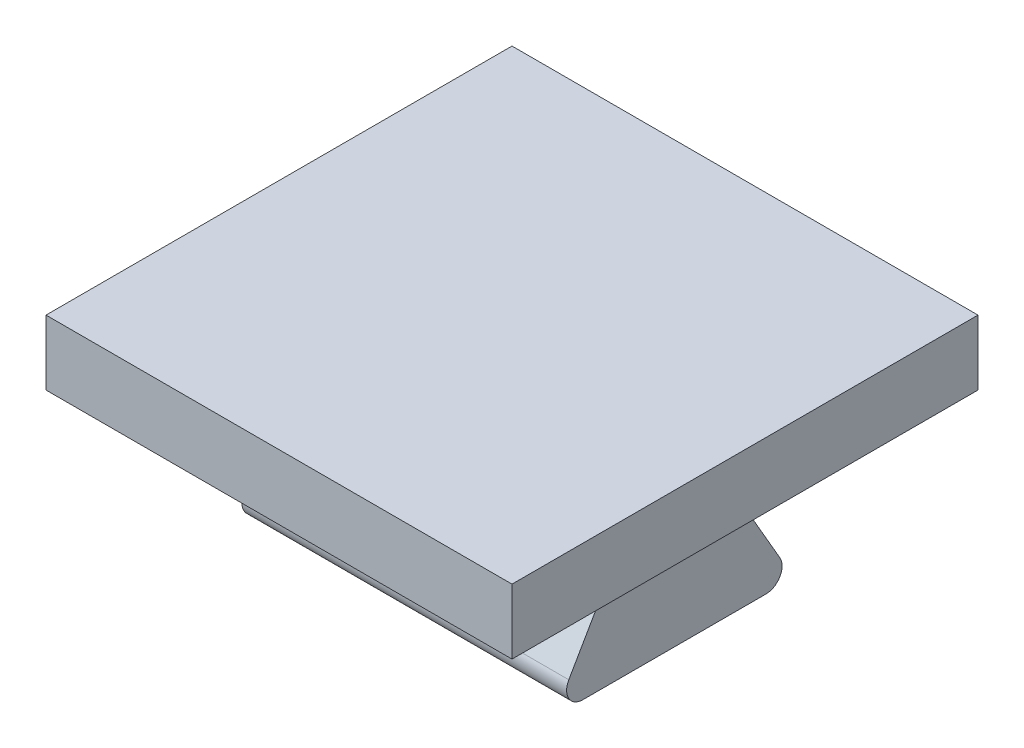
from build123d import *

# Parameters (mm, degrees)
SKETCH2_W           = 14.35
SKETCH2_H           = 14.35
BOSS_EXTRUDE1_DEPTH = 3
BOSS_EXTRUDE2_DEPTH = 5
SKETCH4_W           = 14.35
SKETCH4_H           = 14.35
SKETCH4_W_2         = 10
SKETCH4_H_2         = 7.368246804
CUT_EXTRUDE1_DEPTH  = 1
FILLET1_R           = 0.5


with BuildPart() as part:
    # Sketch2 → Boss-Extrude1 (new body)
    with BuildSketch(Plane(origin=(0, 0, 0), x_dir=(1, 0, 0), z_dir=(0, 1, 0))):
        Rectangle(SKETCH2_W, SKETCH2_H)
    extrude(amount=BOSS_EXTRUDE1_DEPTH)

    # Sketch3 → Boss-Extrude2 (add, symmetric)
    with BuildSketch(Plane(origin=(0, 0, 0), x_dir=(0, 0, -1), z_dir=(1, 0, 0))):
        Polygon((-1.75, 0), (1.75, 0), (3.684123402, -3.35), (-3.684123402, -3.35), align=None)
    extrude(amount=BOSS_EXTRUDE2_DEPTH, both=True)

    # Sketch4 → Cut-Extrude1 (cut)
    with BuildSketch(Plane.XZ):
        Rectangle(SKETCH4_W, SKETCH4_H)
        Rectangle(SKETCH4_W_2, SKETCH4_H_2, mode=Mode.SUBTRACT)
    extrude(amount=-CUT_EXTRUDE1_DEPTH, mode=Mode.SUBTRACT)

    # Fillet1
    fillet1_edges = [part.edges().sort_by_distance(p)[0] for p in [
        (0, -3.35, -3.684123402),
        (0, 0, -1.75),
        (0, 0, 1.75),
        (0, -3.35, 3.684123402),
    ]]
    fillet(fillet1_edges, radius=FILLET1_R)


solid = part.part
